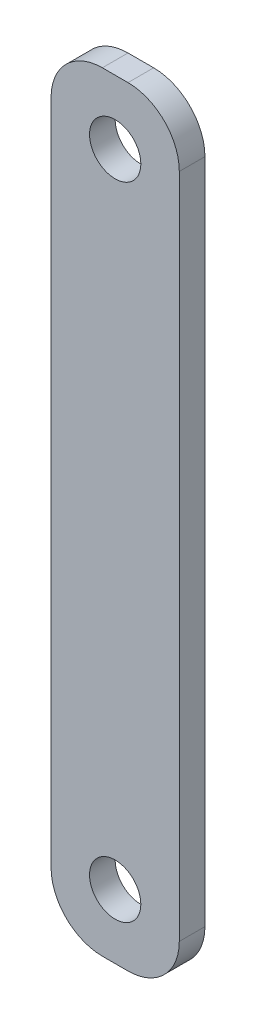
from build123d import *

# Parameters (mm, degrees)
SKETCH1_W           = 5
SKETCH1_H           = 30
SKETCH1_R           = 1
BOSS_EXTRUDE1_DEPTH = 1
FILLET5_R           = 2
FILLET6_R           = 2
FILLET7_R           = 2
FILLET8_R           = 2


with BuildPart() as part:
    # Sketch1 → Boss-Extrude1 (new body)
    with BuildSketch(Plane.XY):
        with Locations((2.5, 15)):
            Rectangle(SKETCH1_W, SKETCH1_H)
        with Locations((2.5, 2.5)):
            Circle(SKETCH1_R, mode=Mode.SUBTRACT)
        with Locations((2.5, 27.5)):
            Circle(SKETCH1_R, mode=Mode.SUBTRACT)
    extrude(amount=BOSS_EXTRUDE1_DEPTH)

    # Fillet5
    fillet5_edges = [part.edges().sort_by_distance(p)[0] for p in [
        (5, 0, 0.5),
    ]]
    fillet(fillet5_edges, radius=FILLET5_R)

    # Fillet6
    fillet6_edges = [part.edges().sort_by_distance(p)[0] for p in [
        (0, 0, 0.5),
    ]]
    fillet(fillet6_edges, radius=FILLET6_R)

    # Fillet7
    fillet7_edges = [part.edges().sort_by_distance(p)[0] for p in [
        (0, 30, 0.5),
    ]]
    fillet(fillet7_edges, radius=FILLET7_R)

    # Fillet8
    fillet8_edges = [part.edges().sort_by_distance(p)[0] for p in [
        (5, 30, 0.5),
    ]]
    fillet(fillet8_edges, radius=FILLET8_R)


solid = part.part
